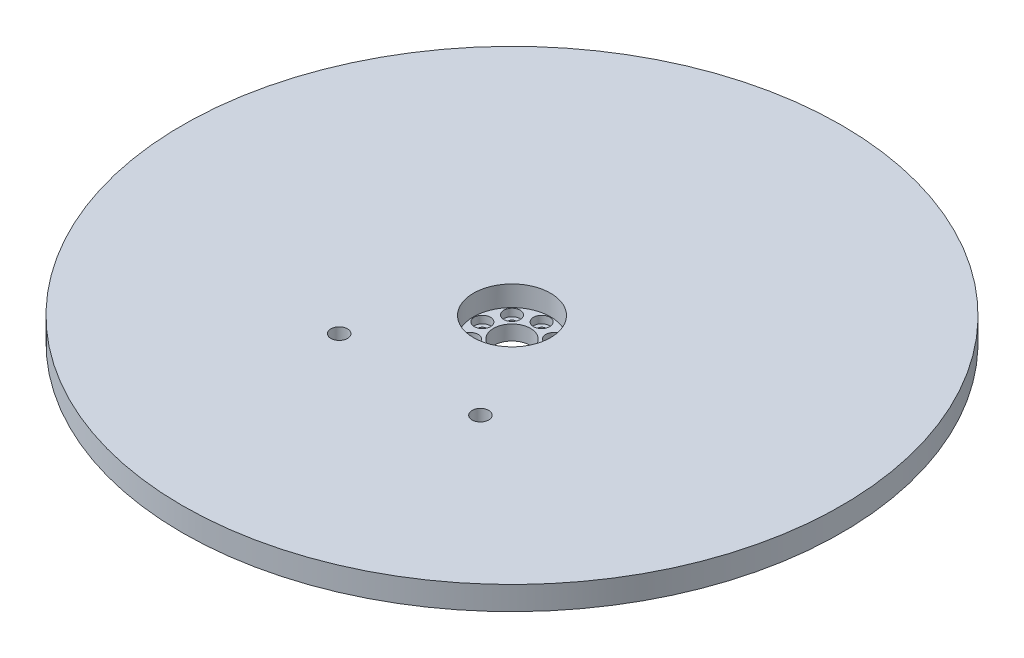
from build123d import *

# Parameters (mm, degrees)
SKETCH1_R                      = 88.9
BOSS_EXTRUDE1_DEPTH            = 3.175
SKETCH2_R                      = 12.065
BOSS_EXTRUDE2_DEPTH            = 3.175
SKETCH5_R                      = 10.4
CUT_EXTRUDE1_DEPTH             = 5.525
SKETCH6_R                      = 5
CUT_EXTRUDE2_DEPTH             = 4
CBORE_FOR_M2_SHCS1_D           = 2.2
CBORE_FOR_M2_SHCS1_DEPTH       = 6
CBORE_FOR_M2_SHCS1_CBORE_D     = 4.4
CBORE_FOR_M2_SHCS1_CBORE_DEPTH = 2
CBORE_FOR_M2_SHCS1_TIP         = 0.660946681
M4_CLEARANCE_HOLE1_D           = 4.5


with BuildPart() as part:
    # Sketch1 → Boss-Extrude1 (new, symmetric)
    with BuildSketch(Plane(origin=(0, 0, 0), x_dir=(1, 0, 0), z_dir=(0, 1, 0))):
        with Locations(Location((0, 0, 0), (0, 0, 270))):
            Circle(SKETCH1_R)
    extrude(amount=BOSS_EXTRUDE1_DEPTH, both=True)

    # Sketch2 → Boss-Extrude2 (add)
    with BuildSketch(Plane.XZ.offset(3.175)):
        with Locations(Location((0, 0, 0), (0, 0, 90))):
            Circle(SKETCH2_R)
    extrude(amount=BOSS_EXTRUDE2_DEPTH)

    # Sketch5 → Cut-Extrude1 (cut)
    with BuildSketch(Plane(origin=(0, 3.175, 0), x_dir=(1, 0, 0), z_dir=(0, 1, 0))):
        with Locations(Location((0, 0, 0), (0, 0, 270))):
            Circle(SKETCH5_R)
    extrude(amount=-CUT_EXTRUDE1_DEPTH, mode=Mode.SUBTRACT)

    # Sketch6 → Cut-Extrude2 (cut)
    with BuildSketch(Plane(origin=(0, -2.35, 0), x_dir=(1, 0, 0), z_dir=(0, 1, 0))):
        with Locations(Location((0, 0, 0), (0, 0, 270))):
            Circle(SKETCH6_R)
    extrude(amount=-CUT_EXTRUDE2_DEPTH, mode=Mode.SUBTRACT)

    # CBORE for M2 SHCS1
    with Locations(Plane(origin=(0, -2.35, 0), x_dir=(1, 0, 0), z_dir=(0, 1, 0))):
        with Locations((-5.65685425, 5.65685425), (0, 8), (5.65685425, 5.65685425), (8, 0), (5.65685425, -5.65685425), (0, -8), (-5.65685425, -5.65685425), (-8, 0)):
            CounterBoreHole(CBORE_FOR_M2_SHCS1_D / 2, CBORE_FOR_M2_SHCS1_CBORE_D / 2, CBORE_FOR_M2_SHCS1_CBORE_DEPTH, depth=CBORE_FOR_M2_SHCS1_DEPTH)
            with Locations((0, 0, -(CBORE_FOR_M2_SHCS1_DEPTH + CBORE_FOR_M2_SHCS1_TIP / 2))):  # 118° drill point
                Cone(0, CBORE_FOR_M2_SHCS1_D / 2, CBORE_FOR_M2_SHCS1_TIP, mode=Mode.SUBTRACT)

    # M4 Clearance Hole1 (through all)
    with Locations(Plane(origin=(0, 3.175, 0), x_dir=(1, 0, 0), z_dir=(0, 1, 0))):
        with Locations((19.05, -27.564242343), (-19.05, -27.564242343)):
            Hole(M4_CLEARANCE_HOLE1_D / 2)


solid = part.part
